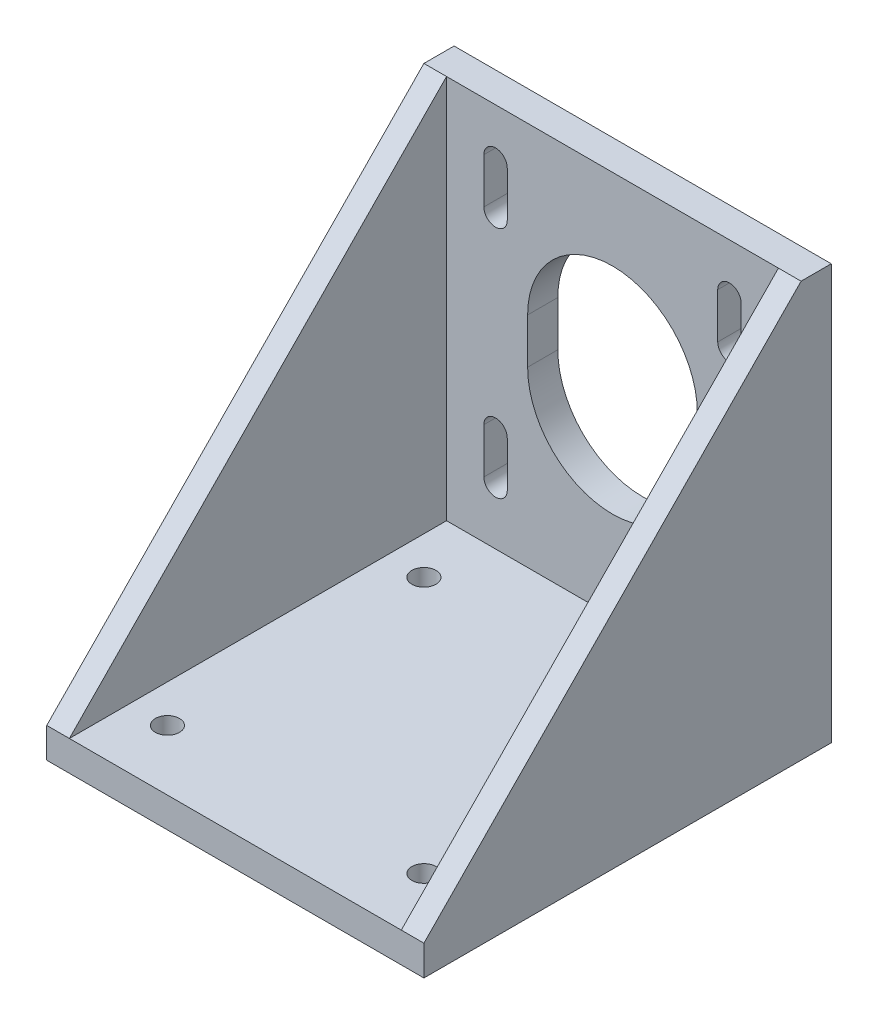
from build123d import *

# Parameters (mm, degrees)
SKETCH3_W           = 50
SKETCH3_H           = 50
SKETCH3_R           = 1.6
BOSS_EXTRUDE1_DEPTH = 4
BOSS_EXTRUDE3_DEPTH = 4
BOSS_EXTRUDE4_DEPTH = 3
BOSS_EXTRUDE5_DEPTH = 3


with BuildPart() as part:
    # Sketch3 → Boss-Extrude1 (new body)
    with BuildSketch(Plane(origin=(0, 0, 0), x_dir=(1, 0, 0), z_dir=(0, 1, 0))):
        with Locations((30.55, 30.55)):
            Rectangle(SKETCH3_W, SKETCH3_H)
        with Locations(Location((13.55, 47.55, 0), (0, 0, 270))):
            Circle(SKETCH3_R, mode=Mode.SUBTRACT)
        with Locations(Location((47.55, 47.55, 0), (0, 0, 270))):
            Circle(SKETCH3_R, mode=Mode.SUBTRACT)
        with Locations(Location((13.55, 13.55, 0), (0, 0, 270))):
            Circle(SKETCH3_R, mode=Mode.SUBTRACT)
        with Locations(Location((47.55, 13.55, 0), (0, 0, 270))):
            Circle(SKETCH3_R, mode=Mode.SUBTRACT)
    extrude(amount=BOSS_EXTRUDE1_DEPTH)

    # Sketch5 → Boss-Extrude3 (add)
    with BuildSketch(Plane(origin=(0, 0, -55.55), x_dir=(-1, 0, 0), z_dir=(0, 0, -1))):
        Polygon((-55.55, 4), (-55.55, 48.5), (-55.55, 55), (-46.05, 55), (-5.55, 55), (-5.55, 48.5), (-5.55, 5), (-5.55, 0), (-55.55, 0), align=None)
        with BuildLine():
            Line((-41.8, 33), (-41.8, 27))
            ThreePointArc((-41.8, 27), (-30.55, 15.75), (-19.3, 27))
            Line((-19.3, 27), (-19.3, 33))
            ThreePointArc((-19.3, 33), (-30.55, 44.25), (-41.8, 33))
        make_face(mode=Mode.SUBTRACT)
        with BuildLine():
            Line((-47.6, 48.5), (-47.6, 42.5))
            ThreePointArc((-47.6, 42.5), (-46.05, 40.95), (-44.5, 42.5))
            Line((-44.5, 42.5), (-44.5, 48.5))
            ThreePointArc((-44.5, 48.5), (-46.05, 50.05), (-47.6, 48.5))
        make_face(mode=Mode.SUBTRACT)
        with BuildLine():
            Line((-16.6, 48.5), (-16.6, 42.5))
            ThreePointArc((-16.6, 42.5), (-15.05, 40.95), (-13.5, 42.5))
            Line((-13.5, 42.5), (-13.5, 48.5))
            ThreePointArc((-13.5, 48.5), (-15.05, 50.05), (-16.6, 48.5))
        make_face(mode=Mode.SUBTRACT)
        with BuildLine():
            Line((-16.6, 17.5), (-16.6, 11.5))
            ThreePointArc((-16.6, 11.5), (-15.05, 9.95), (-13.5, 11.5))
            Line((-13.5, 11.5), (-13.5, 17.5))
            ThreePointArc((-13.5, 17.5), (-15.05, 19.05), (-16.6, 17.5))
        make_face(mode=Mode.SUBTRACT)
        with BuildLine():
            Line((-47.6, 17.5), (-47.6, 11.5))
            ThreePointArc((-47.6, 11.5), (-46.05, 9.95), (-44.5, 11.5))
            Line((-44.5, 11.5), (-44.5, 17.5))
            ThreePointArc((-44.5, 17.5), (-46.05, 19.05), (-47.6, 17.5))
        make_face(mode=Mode.SUBTRACT)
    extrude(amount=BOSS_EXTRUDE3_DEPTH)

    # Sketch7 → Boss-Extrude4 (add)
    with BuildSketch(Plane(origin=(55.55, 0, 0), x_dir=(0, 0, -1), z_dir=(1, 0, 0))):
        Polygon((55.55, 55), (5.55, 4), (55.55, 4), align=None)
    extrude(amount=-BOSS_EXTRUDE4_DEPTH)

    # Sketch8 → Boss-Extrude5 (add)
    with BuildSketch(Plane.ZY.offset(-5.55)):
        Polygon((-55.55, 55), (-5.55, 4), (-55.55, 4), align=None)
    extrude(amount=-BOSS_EXTRUDE5_DEPTH)


solid = part.part
